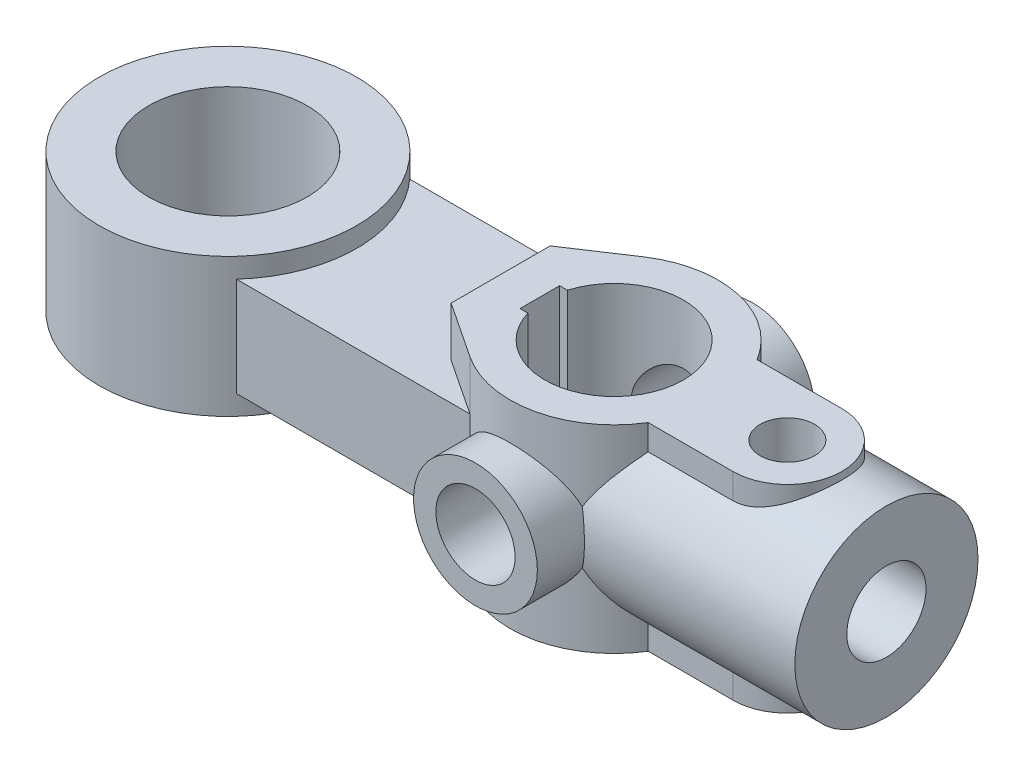
from build123d import *

# Parameters (mm, degrees)
EXTRUDE_1_DEPTH          = 10
EXTRUDE_2_REACH          = 43.568
EXTRUDE_2_END_RADIUS     = 10.5
SKETCH_2_R               = 9.25
CUT_EXTRUDE_1_REACH      = 43.568
CUT_EXTRUDE_1_END_RADIUS = 10.5
SKETCH_3_R               = 4
CUT_EXTRUDE_START        = -20
SKETCH_4_R               = 2.75
CUT_EXTRUDE_2_DEPTH      = 20
EXTRUDE_3_DEPTH          = 5
SKETCH_6_R               = 13
EXTRUDE_4_DEPTH          = 7
SKETCH_7_R               = 8
CUT_EXTRUDE_3_DEPTH      = 14
SKETCH_9_R               = 7
CUT_EXTRUDE_4_DEPTH      = 20
EXTRUDE_5_REACH          = 61.439
SKETCH_11_R              = 6.25
CUT_EXTRUDE_5_REACH      = 61.9
SKETCH_12_R              = 4


with BuildPart() as part:
    # 草图1 → 凸台-拉伸1 (new, symmetric)
    with BuildSketch(Plane(origin=(0, 0, 0), x_dir=(1, 0, 0), z_dir=(0, 1, 0))):
        with BuildLine():
            ThreePointArc((8.94427191, 5.5), (2.259602907, 10.253984333), (-5.804093383, 8.75))
            Line((-5.804093383, 8.75), (-11.457431094, 5))
            Line((-11.457431094, 5), (-11.457431094, -5))
            Line((-11.457431094, -5), (-5.804093383, -8.75))
            ThreePointArc((-5.804093383, -8.75), (2.259602907, -10.253984333), (8.94427191, -5.5))
            Line((8.94427191, -5.5), (17.5, -5.5))
            ThreePointArc((17.5, -5.5), (23, 0), (17.5, 5.5))
            Line((17.5, 5.5), (8.94427191, 5.5))
        make_face()
    extrude(amount=EXTRUDE_1_DEPTH, both=True)

    # 凸台-拉伸2: up to this cylinder (the profile starts outside it)
    extrude_2_end = Plane(origin=(0, 0, 0), z_dir=(0, -1, 0)) * Cylinder(EXTRUDE_2_END_RADIUS, 109.136, mode=Mode.PRIVATE)
    # 草图2 → 凸台-拉伸2 (add, up to the surface)
    with BuildSketch(Plane(origin=(27.5, 0, 0), x_dir=(0, 0, -1), z_dir=(1, 0, 0)), mode=Mode.PRIVATE) as extrude_2_sk1:
        Circle(SKETCH_2_R)
    extrude_2_tool1 = extrude(extrude_2_sk1.sketch, amount=-EXTRUDE_2_REACH, mode=Mode.PRIVATE) - extrude_2_end
    add(extrude_2_tool1.solids().sort_by_distance((27.5, 0, 0))[0])

    # 切除-拉伸1: up to this cylinder (the profile starts outside it)
    cut_extrude_1_end = Plane(origin=(0, 0, 0), z_dir=(0, -1, 0)) * Cylinder(CUT_EXTRUDE_1_END_RADIUS, 109.136, mode=Mode.PRIVATE)
    # 草图3 → 切除-拉伸1 (cut, up to the surface)
    with BuildSketch(Plane(origin=(27.5, 0, 0), x_dir=(0, 0, -1), z_dir=(1, 0, 0)), mode=Mode.PRIVATE) as cut_extrude_1_sk1:
        Circle(SKETCH_3_R)
    cut_extrude_1_tool1 = extrude(cut_extrude_1_sk1.sketch, amount=-CUT_EXTRUDE_1_REACH, mode=Mode.PRIVATE) - cut_extrude_1_end
    add(cut_extrude_1_tool1.solids().sort_by_distance((27.5, 0, 0))[0], mode=Mode.SUBTRACT)

    # 草图4 → 切除-拉伸2 (cut)
    with BuildSketch(Plane(origin=(0, 10, 0), x_dir=(1, 0, 0), z_dir=(0, 1, 0)).offset(CUT_EXTRUDE_START)):
        with Locations(Location((17.5, 0, 0), (0, 0, 270))):
            Circle(SKETCH_4_R)
    extrude(amount=CUT_EXTRUDE_2_DEPTH, mode=Mode.SUBTRACT)

    # 草图5 → 凸台-拉伸3 (add, symmetric)
    with BuildSketch(Plane(origin=(0, 0, 0), x_dir=(1, 0, 0), z_dir=(0, 1, 0))):
        Polygon((-5.804093383, 8.75), (-11.457431094, 5), (-11.457431094, -5), (-5.804093383, -8.75), (-39, -8.75), (-39, 8.75), align=None)
    extrude(amount=EXTRUDE_3_DEPTH, both=True)

    # 草图6 → 凸台-拉伸4 (add, symmetric)
    with BuildSketch(Plane(origin=(0, 0, 0), x_dir=(1, 0, 0), z_dir=(0, 1, 0))):
        with Locations(Location((-39, 0, 0), (0, 0, 270))):
            Circle(SKETCH_6_R)
    extrude(amount=EXTRUDE_4_DEPTH, both=True)

    # 草图7 → 切除-拉伸3 (cut)
    with BuildSketch(Plane(origin=(0, 7, 0), x_dir=(1, 0, 0), z_dir=(0, 1, 0))):
        with Locations(Location((-39, 0, 0), (0, 0, 270))):
            Circle(SKETCH_7_R)
    extrude(amount=-CUT_EXTRUDE_3_DEPTH, mode=Mode.SUBTRACT)

    # 草图9 → 切除-拉伸4 (cut)
    with BuildSketch(Plane(origin=(0, 10, 0), x_dir=(1, 0, 0), z_dir=(0, 1, 0))):
        with BuildLine():
            Line((-6.708203932, 2), (-7.498203932, 2))
            Line((-7.498203932, 2), (-7.498203932, -2))
            Line((-7.498203932, -2), (-6.708203932, -2))
            ThreePointArc((-6.708203932, -2), (-7, 0), (-6.708203932, 2))
        make_face()
        Circle(SKETCH_9_R)
    extrude(amount=-CUT_EXTRUDE_4_DEPTH, mode=Mode.SUBTRACT)

    # 草图11 → 凸台-拉伸5 (add, up to next)
    with BuildSketch(Plane.XY.offset(14), mode=Mode.PRIVATE) as extrude_5_sk1:
        Circle(SKETCH_11_R)
    extrude_5_tool1 = extrude(extrude_5_sk1.sketch, amount=-EXTRUDE_5_REACH, mode=Mode.PRIVATE) - part.part
    extrude_5 = extrude_5_tool1.solids().sort_by_distance((0, 0, 14))[0]
    add(extrude_5)

    # 镜向1: 凸台-拉伸5 across plane
    add(extrude_5.mirror(Plane.XY))

    # 切除-拉伸5: up to this face of the body (flat: up to its plane)
    cut_extrude_5_end = Plane(part.part.faces().sort_by_distance((0, 0, -14))[0])
    # 草图12 → 切除-拉伸5 (cut, up to the picked face)
    with BuildSketch(Plane.XY.offset(14), mode=Mode.PRIVATE) as cut_extrude_5_sk1:
        Circle(SKETCH_12_R)
    cut_extrude_5_tool1 = split(extrude(cut_extrude_5_sk1.sketch, amount=-CUT_EXTRUDE_5_REACH, mode=Mode.PRIVATE), bisect_by=cut_extrude_5_end, keep=Keep.BOTH, mode=Mode.PRIVATE)
    add(cut_extrude_5_tool1.solids().sort_by(Axis((0, 0, 14), (0, 0, -1)))[0], mode=Mode.SUBTRACT)


solid = part.part
